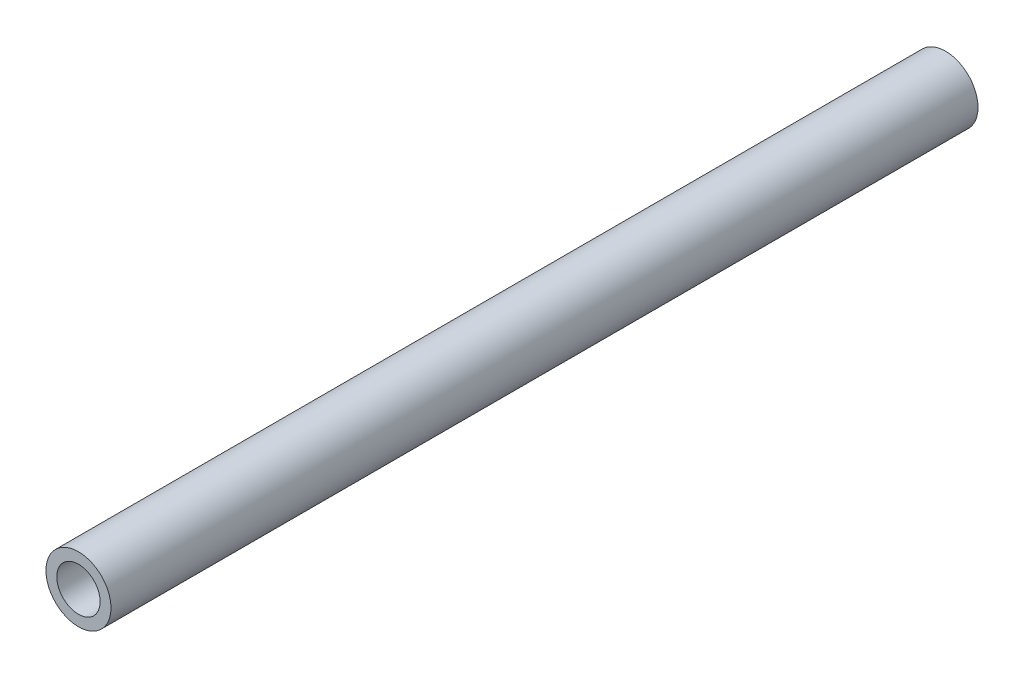
from build123d import *

# Parameters (mm, degrees)
ESQUISSE1_R        = 3
ESQUISSE1_R_2      = 2
EXTRU_MINCE1_DEPTH = 80


with BuildPart() as part:
    # Esquisse1 → Extru.-Mince1 (new body)
    with BuildSketch(Plane.XY):
        Circle(ESQUISSE1_R)
        Circle(ESQUISSE1_R_2, mode=Mode.SUBTRACT)
    extrude(amount=EXTRU_MINCE1_DEPTH)


solid = part.part
